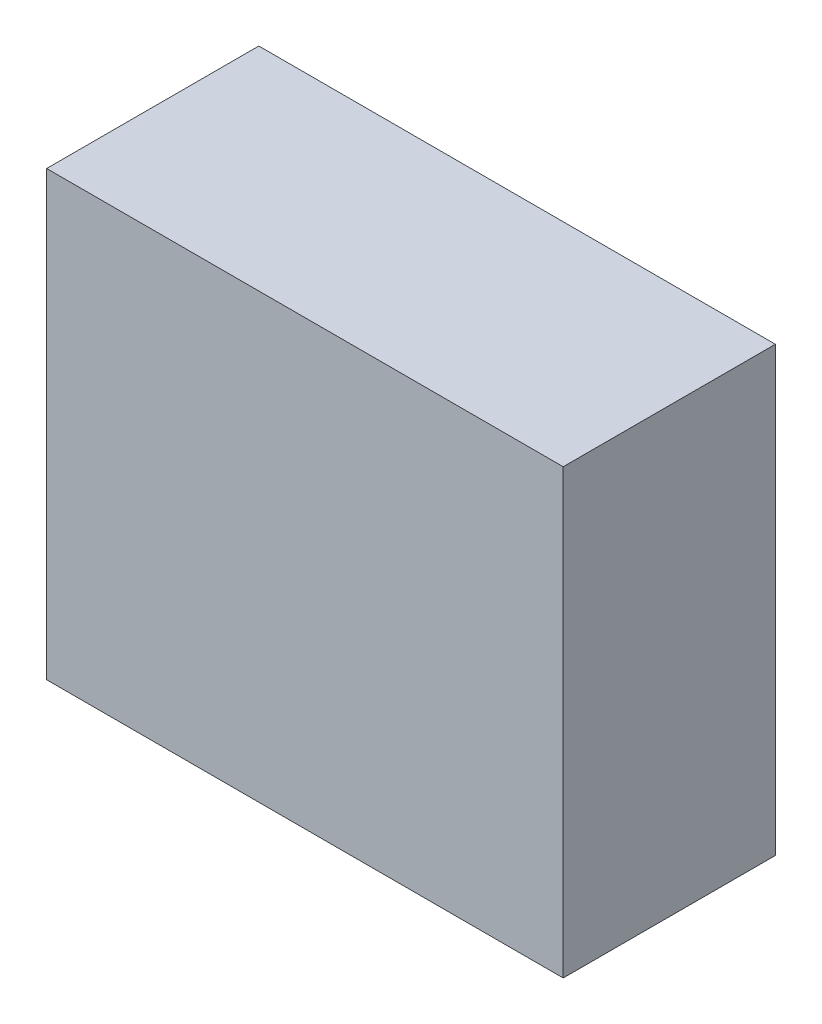
from build123d import *

# Parameters (mm, degrees)
SKETCH1_W           = 28
SKETCH1_H           = 11.5
BOSS_EXTRUDE1_DEPTH = 24


with BuildPart() as part:
    # Sketch1 → Boss-Extrude1 (new body)
    with BuildSketch(Plane(origin=(0, 0, 0), x_dir=(1, 0, 0), z_dir=(0, 1, 0))):
        with Locations((9.365631234, -1.353448276)):
            Rectangle(SKETCH1_W, SKETCH1_H)
    extrude(amount=BOSS_EXTRUDE1_DEPTH)


solid = part.part
